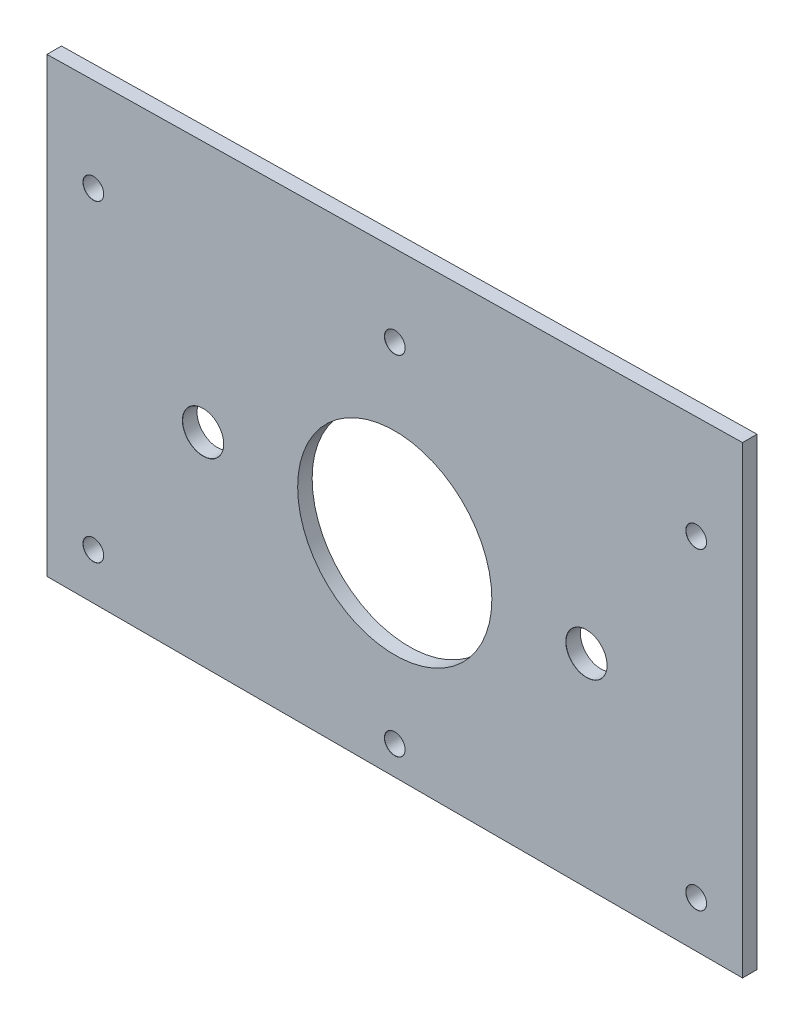
from build123d import *

# Parameters (mm, degrees)
BOSS_EXTRUDE1_DEPTH            = 3.175
M4_CLEARANCE_HOLE1_D           = 4.5
M4_CLEARANCE_HOLE1_CSINK_D     = 4.55
M4_CLEARANCE_HOLE1_CSINK_ANGLE = 90
M8_CLEARANCE_HOLE1_AT_2_COUNT  = 2
M8_CLEARANCE_HOLE1_AT_2_PITCH  = 84
SKETCH9_R                      = 21.275
CENTER_HOLE_DEPTH              = 96.302901976


with BuildPart() as part:
    # Sketch1 → Boss-Extrude1 (new body)
    with BuildSketch(Plane.XY):
        Polygon((-76.2, 54.61), (-76.2, 44.45), (-76.2, -44.45), (76.2, -44.45), (76.2, 44.45), (76.2, 57.15), align=None)
    extrude(amount=BOSS_EXTRUDE1_DEPTH)

    # M4 Clearance Hole1 (through all)
    with Locations(Plane.XY.offset(3.175)):
        with Locations((0, 38.1), (-66.04, 34.29), (-66.04, -34.29), (0, -38.1), (66.04, -34.29), (66.04, 34.29)):
            CounterSinkHole(M4_CLEARANCE_HOLE1_D / 2, M4_CLEARANCE_HOLE1_CSINK_D / 2, counter_sink_angle=M4_CLEARANCE_HOLE1_CSINK_ANGLE)

    # Sketch11 → M8 Clearance Hole1 (revolve, cut)
    with BuildSketch(Plane(origin=(-42, 0, 3.175), x_dir=(0, -1, 0), z_dir=(1, 0, 0))):
        Polygon((0, 0), (0, 3.175), (4.5, 3.175), (4.5, 0.025), (4.525, 0), align=None)
    m8_clearance_hole1 = revolve(axis=Axis((-42, 0, 9.525), (0, 0, -1)), mode=Mode.SUBTRACT)

    # M8 Clearance Hole1 at 2: M8 Clearance Hole1 ×2
    with Locations(*[(i * M8_CLEARANCE_HOLE1_AT_2_PITCH, 0, 0) for i in range(1, M8_CLEARANCE_HOLE1_AT_2_COUNT)]):
        add(m8_clearance_hole1, mode=Mode.SUBTRACT)

    # Sketch9 → Center Hole (cut, through all)
    with BuildSketch(Plane.XY.offset(3.175)):
        Circle(SKETCH9_R)
    extrude(amount=-CENTER_HOLE_DEPTH, mode=Mode.SUBTRACT)


solid = part.part
